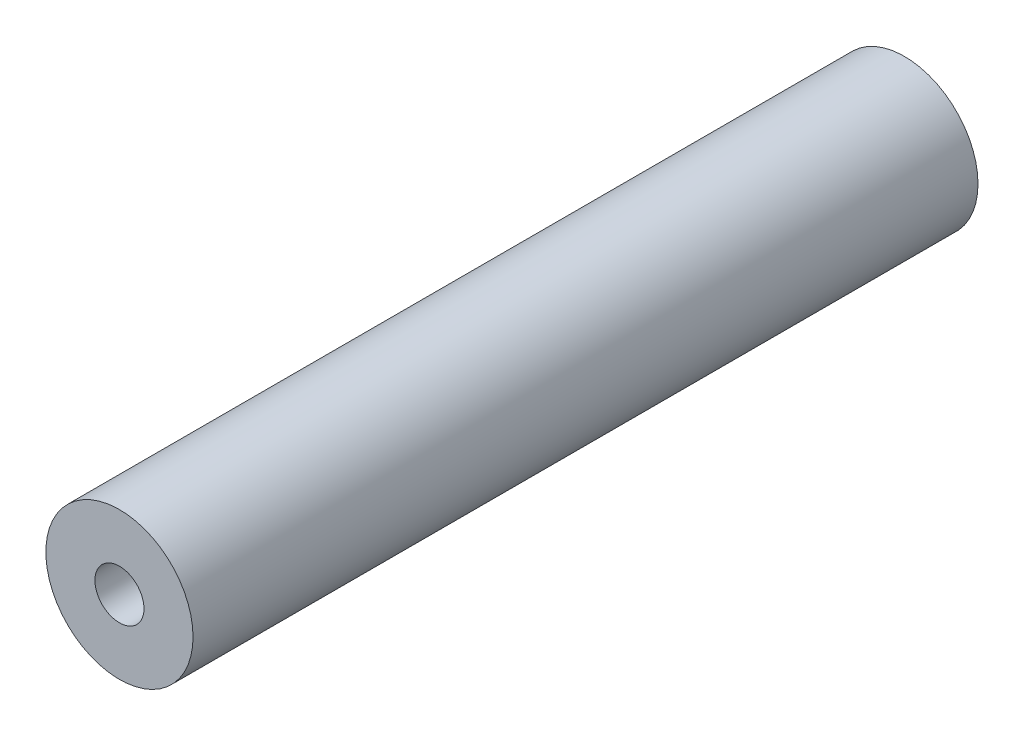
from build123d import *

# Parameters (mm, degrees)
SKETCH1_R           = 4.7625
SKETCH1_R_2         = 1.5875
BOSS_EXTRUDE1_DEPTH = 50.8


with BuildPart() as part:
    # Sketch1 → Boss-Extrude1 (new body)
    with BuildSketch(Plane.XY):
        Circle(SKETCH1_R)
        Circle(SKETCH1_R_2, mode=Mode.SUBTRACT)
    extrude(amount=BOSS_EXTRUDE1_DEPTH)


solid = part.part
